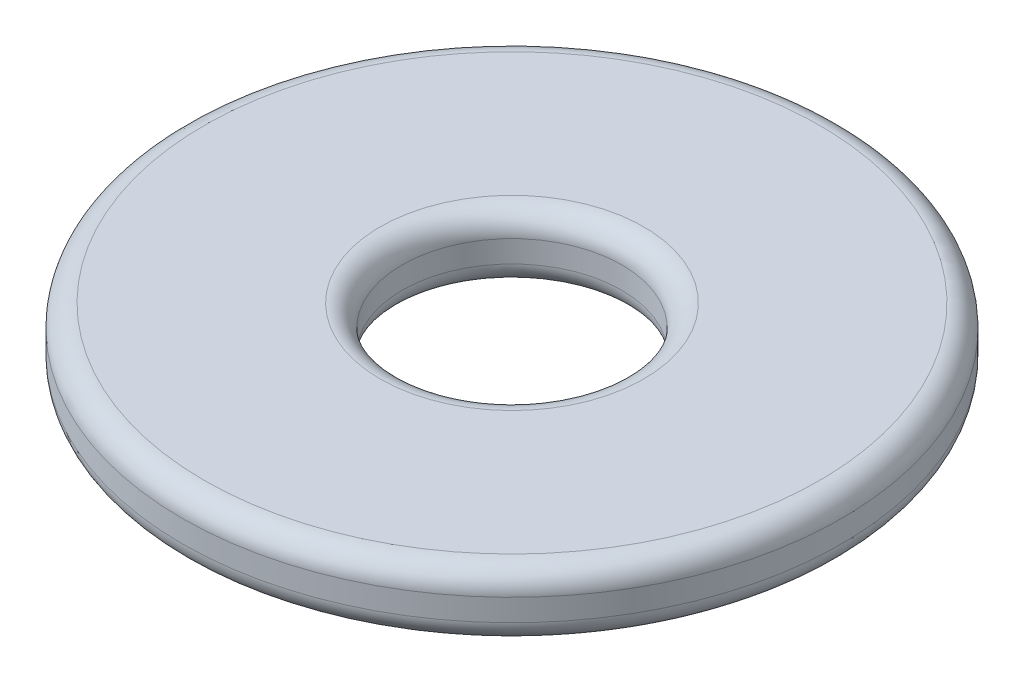
from build123d import *

# Parameters (mm, degrees)
SKETCH1_R           = 6
SKETCH1_R_2         = 2
BOSS_EXTRUDE1_DEPTH = 1.2
FILLET1_R           = 0.4


with BuildPart() as part:
    # Sketch1 → Boss-Extrude1 (new body)
    with BuildSketch(Plane(origin=(0, 0, 0), x_dir=(1, 0, 0), z_dir=(0, 1, 0))):
        with Locations(Location((0, 0, 0), (0, 0, 270))):
            Circle(SKETCH1_R)
        with Locations(Location((0, 0, 0), (0, 0, 270))):
            Circle(SKETCH1_R_2, mode=Mode.SUBTRACT)
    extrude(amount=BOSS_EXTRUDE1_DEPTH)

    # Fillet1
    fillet1_edges = [part.edges().sort_by_distance(p)[0] for p in [
        (0, 0, -6),
        (0, 1.2, -6),
        (0, 0, -2),
        (0, 1.2, -2),
    ]]
    fillet(fillet1_edges, radius=FILLET1_R)


solid = part.part
